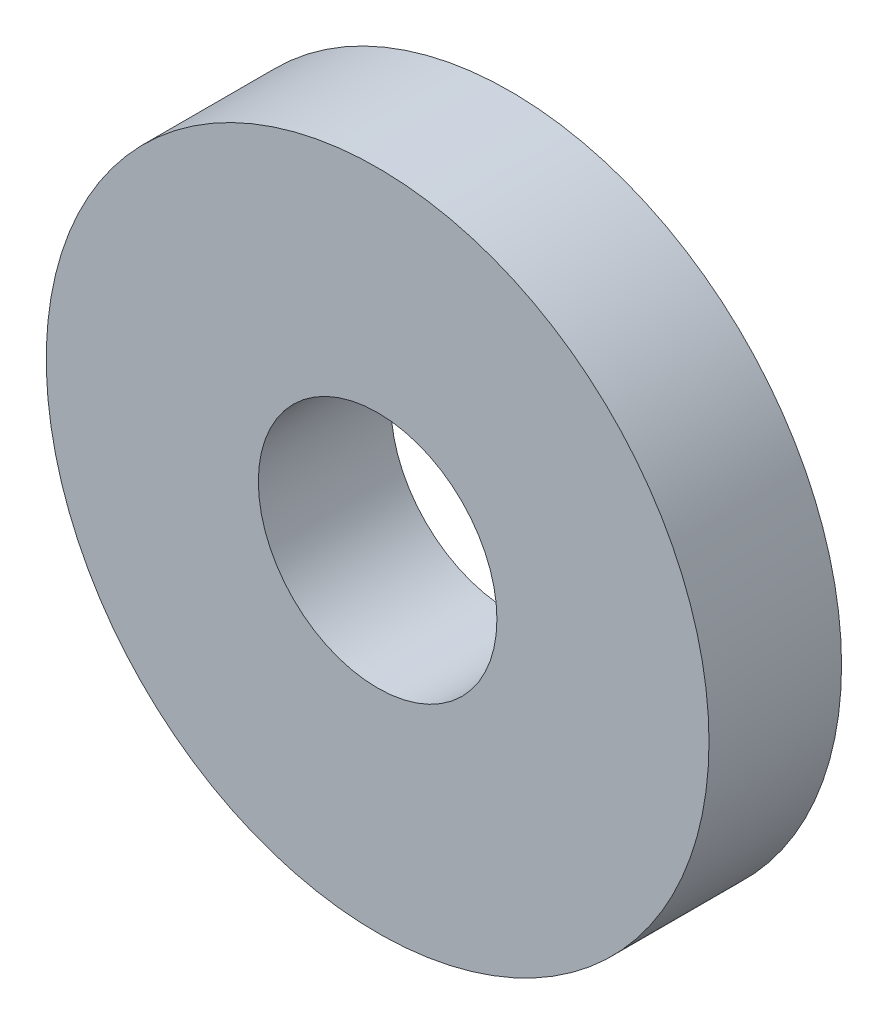
from build123d import *

# Parameters (mm, degrees)
SCHIZZO1_R                   = 12.5
SCHIZZO1_R_2                 = 4.5
ESTRUSIONE_ESTRUSIONE1_DEPTH = 5


with BuildPart() as part:
    # Schizzo1 → Estrusione-Estrusione1 (new body)
    with BuildSketch(Plane.XY):
        Circle(SCHIZZO1_R)
        Circle(SCHIZZO1_R_2, mode=Mode.SUBTRACT)
    extrude(amount=ESTRUSIONE_ESTRUSIONE1_DEPTH)


solid = part.part
